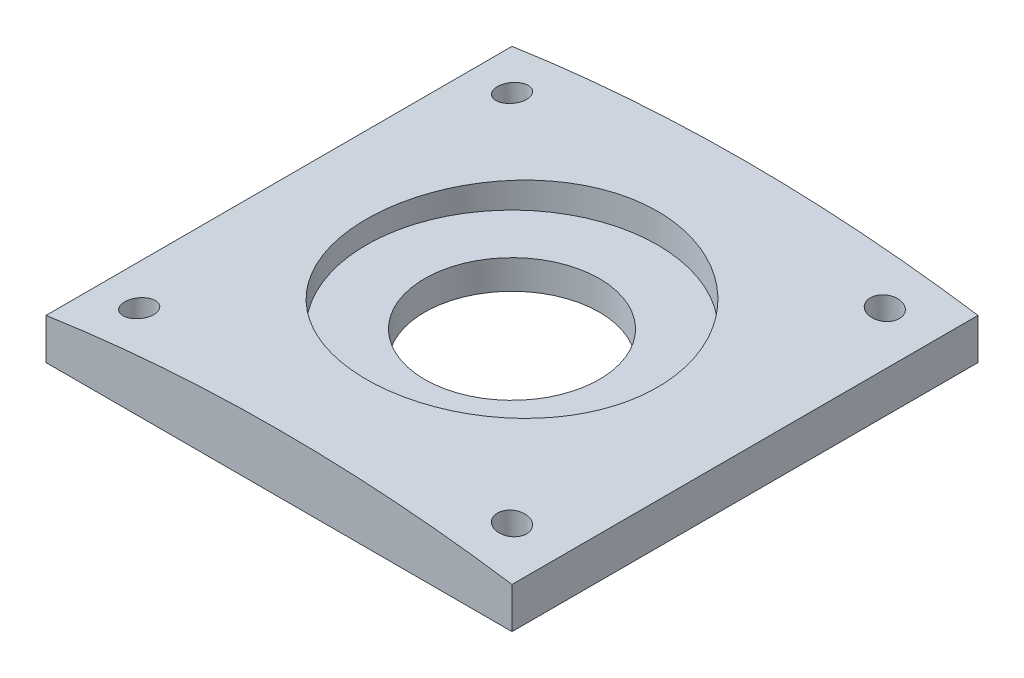
from build123d import *
from build123d.topology import SkipClean

# Parameters (mm, degrees)
SKETCH1_3_W             = 80
SKETCH1_3_H             = 80
SKETCH1_3_R             = 2.5
SKETCH1_3_R_2           = 15
BOSS_EXTRUDE3_DEPTH     = 5
BOSS_EXTRUDE4_START     = 5
SKETCH1_W               = 80
SKETCH1_H               = 80
SKETCH1_R               = 2.5
SKETCH1_R_2             = 25
BOSS_EXTRUDE4_DEPTH     = 5
CUT_EXTRUDE2_DEPTH      = 57.789083458
CUT_EXTRUDE2_DEPTH_BACK = 57.789083458
CUT_EXTRUDE3_DEPTH      = 57.789083608
CUT_EXTRUDE3_DEPTH_BACK = 57.789083608


with BuildPart() as part:
    # Sketch1<3> → Boss-Extrude3 (new body)
    with BuildSketch(Plane(origin=(0, 0, 0), x_dir=(1, 0, 0), z_dir=(0, 1, 0))):
        Rectangle(SKETCH1_3_W, SKETCH1_3_H)
        with Locations((-32, -32)):
            Circle(SKETCH1_3_R, mode=Mode.SUBTRACT)
        with Locations((32, -32)):
            Circle(SKETCH1_3_R, mode=Mode.SUBTRACT)
        with Locations((-32, 32)):
            Circle(SKETCH1_3_R, mode=Mode.SUBTRACT)
        with Locations((32, 32)):
            Circle(SKETCH1_3_R, mode=Mode.SUBTRACT)
        Circle(SKETCH1_3_R_2, mode=Mode.SUBTRACT)
    extrude(amount=-BOSS_EXTRUDE3_DEPTH)

    # Sketch1 → Boss-Extrude4 (add)
    with BuildSketch(Plane(origin=(0, 0, 0), x_dir=(1, 0, 0), z_dir=(0, 1, 0)).offset(BOSS_EXTRUDE4_START)):
        Rectangle(SKETCH1_W, SKETCH1_H)
        with Locations((-32, -32)):
            Circle(SKETCH1_R, mode=Mode.SUBTRACT)
        with Locations((32, -32)):
            Circle(SKETCH1_R, mode=Mode.SUBTRACT)
        Circle(SKETCH1_R_2, mode=Mode.SUBTRACT)
        with Locations((-32, 32)):
            Circle(SKETCH1_R, mode=Mode.SUBTRACT)
        with Locations((32, 32)):
            Circle(SKETCH1_R, mode=Mode.SUBTRACT)
    extrude(amount=-BOSS_EXTRUDE4_DEPTH)

    # Sketch3 → Cut-Extrude2 (cut, two sides: drawn at the far end of the back side and taken through both)
    with BuildSketch(Plane.XY.offset(-CUT_EXTRUDE2_DEPTH_BACK)):
        with BuildLine():
            Line((-40, 2.020598456), (-40, 5))
            Line((-40, 5), (0, 5))
            ThreePointArc((0, 5), (-20.055403471, 4.254119359), (-40, 2.020598456))
        make_face()
    extrude(amount=CUT_EXTRUDE2_DEPTH + CUT_EXTRUDE2_DEPTH_BACK, mode=Mode.SUBTRACT)

    # Sketch3<4> → Cut-Extrude3 (cut, two sides: drawn at the far end of the back side and taken through both)
    with SkipClean():  # the faces are left unmerged after this step: merging them gives an invalid solid
        with BuildSketch(Plane.XY.offset(-CUT_EXTRUDE3_DEPTH_BACK)):
            with BuildLine():
                Line((40, 5), (40, 2.020598456))
                ThreePointArc((40, 2.020598456), (20.055403471, 4.254119359), (0, 5))
                Line((0, 5), (40, 5))
            make_face()
        extrude(amount=CUT_EXTRUDE3_DEPTH + CUT_EXTRUDE3_DEPTH_BACK, mode=Mode.SUBTRACT)


solid = part.part
